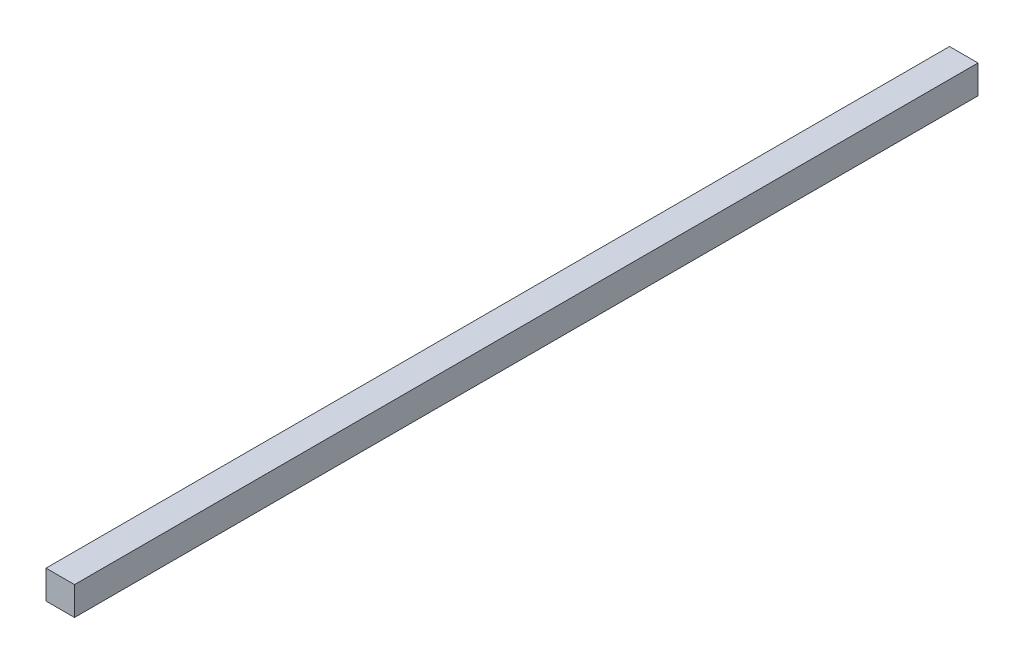
from build123d import *

# Parameters (mm, degrees)
SKETCH1_W      = 25.4
SKETCH1_H      = 25.4
EXTRUDE1_DEPTH = 805.18


with BuildPart() as part:
    # Sketch1 → Extrude1 (new body)
    with BuildSketch(Plane.XY):
        with Locations((169.363630383, -12.7)):
            Rectangle(SKETCH1_W, SKETCH1_H)
    extrude(amount=-EXTRUDE1_DEPTH)


solid = part.part
